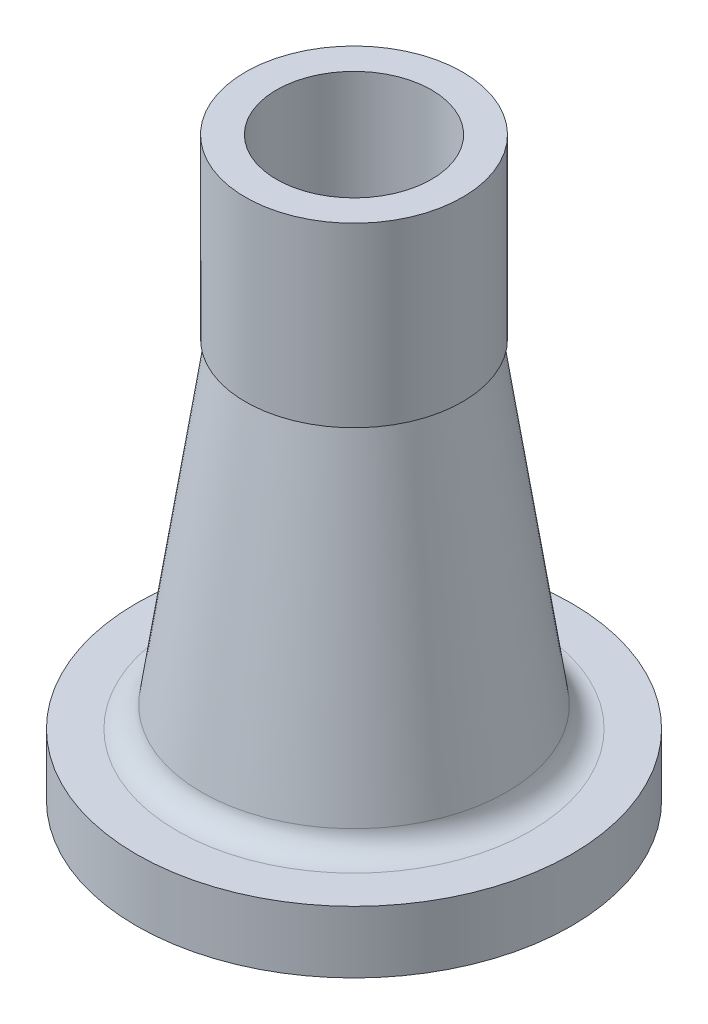
from build123d import *

# Parameters (mm, degrees)
FILLET1_R = 8


with BuildPart() as part:
    # Sketch3 → Revolve1 (revolve)
    with BuildSketch(Plane.XY, mode=Mode.PRIVATE) as revolve1_sk:
        Polygon((25, 185.89945678), (35, 185.89945678), (35, 128.787624663), (33.963762469, 128.787624663), (50.124510314, 20), (70.124510314, 20), (70.124510314, 0), (50, 0), (50, 3.89945678), (42.40655913, 3.89945678), (25, 121.073379639), align=None)
    revolve(revolve1_sk.sketch.rotate(Axis((0, 0, 0), (0, 1, 0)), 90), axis=Axis((0, 0, 0), (0, 1, 0)))

    # Fillet1
    fillet1_edges = [part.edges().sort_by_distance(p)[0] for p in [
        (0, 20, 50.124510314),
    ]]
    fillet(fillet1_edges, radius=FILLET1_R)


solid = part.part
